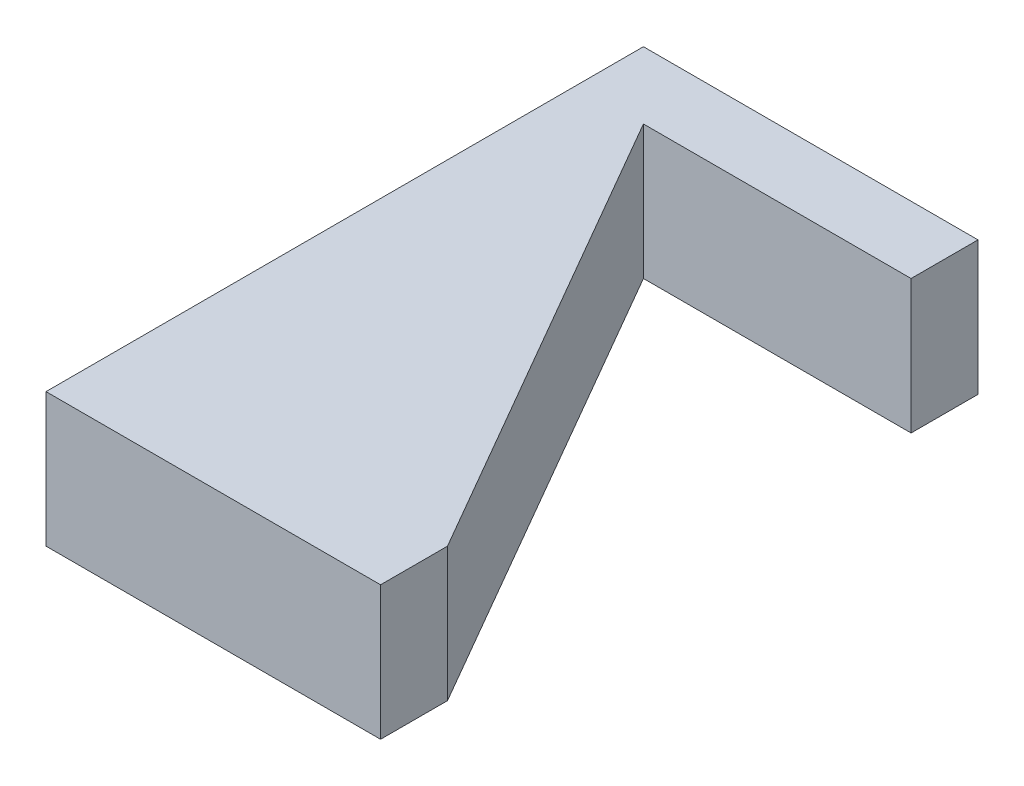
from build123d import *

# Parameters (mm, degrees)
BOSS_EXTRUDE1_DEPTH = 20


with BuildPart() as part:
    # Sketch1 → Boss-Extrude1 (new body)
    with BuildSketch(Plane(origin=(0, 0, 0), x_dir=(1, 0, 0), z_dir=(0, 1, 0))):
        Polygon((0, 0), (0, -89.282032303), (50, -89.282032303), (50, -79.282032303), (10, -10), (50, -10), (50, 0), align=None)
    extrude(amount=BOSS_EXTRUDE1_DEPTH)


solid = part.part
